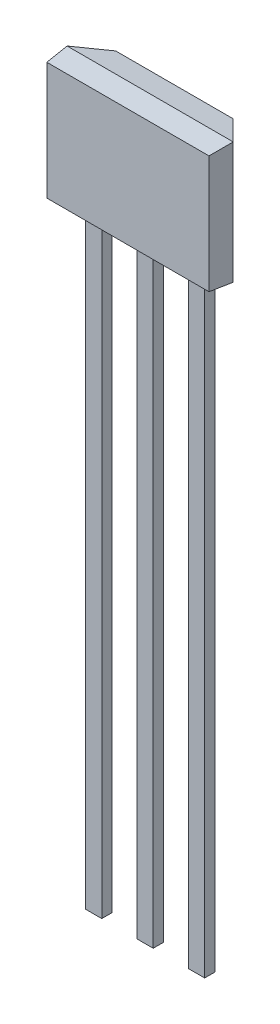
from build123d import *

# Parameters (mm, degrees)
SKETCH_1_W             = 4.1
SKETCH_1_H             = 3
EXTRUDE_1_DEPTH        = 1.15
CUT_EXTRUDE_1_DEPTH    = 4.8111678
CUT_EXTRUDE_2_DEPTH    = 5.926966612
EXTRUDE_2_DEPTH        = 0.125
EXTRUDE_2_DEPTH_BACK   = 0.125
SKETCH_5_W             = 0.4
SKETCH_5_H             = 15.2
EXTRUDE_2_2_DEPTH      = 0.125
EXTRUDE_2_2_DEPTH_BACK = 0.125
EXTRUDE_2_3_DEPTH      = 0.125
EXTRUDE_2_3_DEPTH_BACK = 0.125
SKETCH_7_R             = 0.15
EXTRUDE_3_DEPTH        = 0.1


with BuildPart() as part:
    # 草圖1 → 填料-伸長1 (new body)
    with BuildSketch(Plane.XY):
        Rectangle(SKETCH_1_W, SKETCH_1_H)
    extrude(amount=EXTRUDE_1_DEPTH)

    # 草圖2 → 除料-伸長1 (cut, through all)
    with BuildSketch(Plane.XZ.offset(1.5)):
        Polygon((-1.45, 0), (-2.05, 0.6), (-2.05, 0), align=None)
        Polygon((2.05, 0.6), (1.45, 0), (2.05, 0), align=None)
        Polygon((-2.05, 0.6), (-2.001881235, 1.15), (-2.05, 1.15), align=None)
        Polygon((2.05, 0.6), (2.001881235, 1.15), (2.05, 1.15), align=None)
    extrude(amount=-CUT_EXTRUDE_1_DEPTH, mode=Mode.SUBTRACT)

    # 草圖3 → 除料-伸長2 (cut, through all)
    with BuildSketch(Plane(origin=(2.5, 0, 0), x_dir=(0, 0, -1), z_dir=(1, 0, 0))):
        Polygon((0, -1.5), (-0.6, -1.5), (0, -1.394203812), align=None)
        Polygon((-0.6, -1.5), (-1.15, -1.451881235), (-1.15, -1.5), align=None)
        Polygon((-0.6, 1.5), (-1.15, 1.451881235), (-1.15, 1.5), align=None)
        Polygon((-0.6, 1.5), (0, 1.394203812), (0, 1.5), align=None)
    extrude(amount=-CUT_EXTRUDE_2_DEPTH, mode=Mode.SUBTRACT)


with BuildPart() as body_2:
    # 草圖5 → 填料-伸長2 (new, two sides: drawn at the far end of the back side and taken through both)
    with BuildSketch(Plane.XY.offset(0.6).offset(-EXTRUDE_2_DEPTH_BACK)):
        with Locations((-1.27, -9)):
            Rectangle(SKETCH_5_W, SKETCH_5_H)
    extrude(amount=EXTRUDE_2_DEPTH + EXTRUDE_2_DEPTH_BACK)


with BuildPart() as body_3:
    # 草圖5 → Extrude 2 2 (new, two sides: drawn at the far end of the back side and taken through both)
    with BuildSketch(Plane.XY.offset(0.6).offset(-EXTRUDE_2_2_DEPTH_BACK)):
        with Locations((0, -9)):
            Rectangle(SKETCH_5_W, SKETCH_5_H)
    extrude(amount=EXTRUDE_2_2_DEPTH + EXTRUDE_2_2_DEPTH_BACK)


with BuildPart() as body_4:
    # 草圖5 → Extrude 2 3 (new, two sides: drawn at the far end of the back side and taken through both)
    with BuildSketch(Plane.XY.offset(0.6).offset(-EXTRUDE_2_3_DEPTH_BACK)):
        with Locations((1.27, -9)):
            Rectangle(SKETCH_5_W, SKETCH_5_H)
    extrude(amount=EXTRUDE_2_3_DEPTH + EXTRUDE_2_3_DEPTH_BACK)


with BuildPart() as body_5:
    # 草圖7 → 填料-伸長3 (new body)
    with BuildSketch(Plane.XY.offset(0.41)):
        with Locations((0, 0.79)):
            Circle(SKETCH_7_R)
    extrude(amount=EXTRUDE_3_DEPTH)


solid = Compound([part.part, body_2.part, body_3.part, body_4.part, body_5.part])
